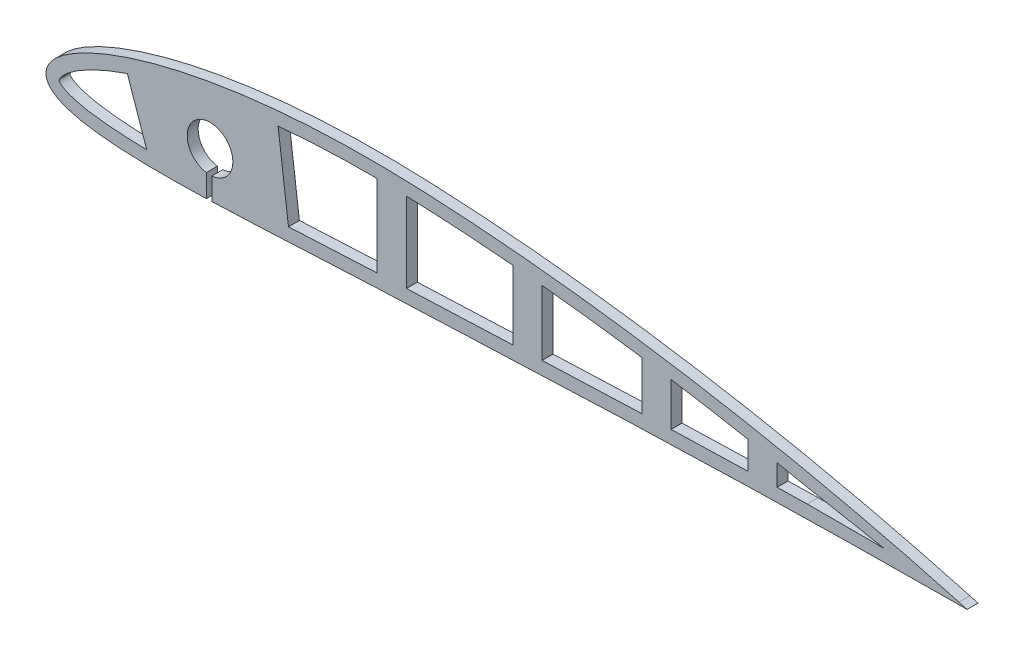
from build123d import *

# Parameters (mm, degrees)
BOSS_EXTRUDE1_DEPTH = 3
CUT_EXTRUDE1_DEPTH  = 10
BOSS_EXTRUDE2_DEPTH = 3
BOSS_EXTRUDE3_DEPTH = 3
SKETCH5_R           = 6.25
CUT_EXTRUDE2_DEPTH  = 3
SKETCH9_W           = 1.5
SKETCH9_H           = 11.04620158
CUT_EXTRUDE3_DEPTH  = 3


with BuildPart() as part:
    # Sketch1 → Boss-Extrude1 (new body)
    with BuildSketch(Plane.XY.offset(1594.665639607)):
        with BuildLine():
            Line((571.512797284, 751.460872145), (569.288571103, 752.085372145))
            add(Edge.make_bspline(
                [(569.288571103, 752.085372145), (569.207824398, 752.107800703), (568.885254245, 752.197399197), (568.160451757, 752.397346563), (566.955590863, 752.729020554), (565.274314978, 753.186620677), (562.100922103, 754.041070604), (558.315248382, 755.035797885), (553.929688252, 756.155409854), (549.988735218, 757.138311996), (545.631545263, 758.196335617), (540.874229892, 759.318134415), (535.733835559, 760.490840684), (530.229687155, 761.703261755), (524.381807715, 762.940721946), (518.212626171, 764.192645876), (511.745065536, 765.44442469), (505.003838301, 766.68395258), (498.015031084, 767.899775904), (490.805315338, 769.077912541), (483.40297947, 770.208104073), (475.836849627, 771.277976405), (468.136926681, 772.276980903), (460.333698001, 773.193978501), (452.458416415, 774.019905164), (444.542771888, 774.745192383), (436.619035759, 775.36189665), (428.71943342, 775.860738937), (420.844010206, 776.243529693), (413.014923526, 776.479731081), (405.264834959, 776.508750538), (397.661509603, 776.343451763), (390.247613389, 775.98562141), (383.05672298, 775.440827622), (376.121242905, 774.719270378), (369.472500577, 773.831502684), (363.14007733, 772.79132549), (357.151942782, 771.613480595), (351.533942201, 770.315331624), (346.309786675, 768.914972062), (341.501037062, 767.431379025), (337.12665352, 765.883899619), (333.202701315, 764.292771048), (329.743150488, 762.676281216), (326.758730352, 761.052775328), (324.257400211, 759.438394996), (322.243393842, 757.846645355), (320.717813869, 756.285368109), (319.680643215, 754.753750296), (319.14584497, 753.23689022), (319.158988787, 751.75550039), (319.715829141, 750.384255644), (320.782461654, 749.188263072), (322.304020001, 748.161146712), (324.269997101, 747.277585802), (326.676265952, 746.525537916), (329.516452781, 745.900149883), (332.780119389, 745.397056661), (336.454163781, 745.012195766), (340.523607036, 744.740673832), (344.971925843, 744.575293946), (349.781621882, 744.510287577), (354.93413472, 744.535655661), (360.410377123, 744.643127394), (366.190534641, 744.821621769), (372.254339569, 745.060094915), (378.580714755, 745.345694536), (385.148343595, 745.666469836), (391.935034571, 746.008922971), (398.918329162, 746.359747912), (406.07476137, 746.70536498), (413.388840069, 747.036214061), (420.868758886, 747.32738551), (428.485589125, 747.623976291), (436.201752576, 747.941269463), (443.955470082, 748.263874579), (451.717294434, 748.585963452), (459.457375674, 748.901819908), (467.14598863, 749.205730899), (474.753126072, 749.493512161), (482.249027102, 749.76210232), (489.604127028, 750.008614341), (496.789137122, 750.232643978), (503.775418318, 750.43266223), (510.534699403, 750.609283097), (517.039571485, 750.762933928), (523.263427655, 750.895745038), (529.180632964, 751.007800712), (534.766738431, 751.102455094), (539.998424273, 751.181117023), (544.853860816, 751.245362272), (549.312372949, 751.297797505), (553.355050668, 751.339855306), (556.96447185, 751.373675903), (560.125145125, 751.399809004), (562.823316535, 751.419920043), (565.047317639, 751.435472176), (566.787319157, 751.446681427), (568.03573631, 751.454290557), (568.786905041, 751.458351465), (569.121404462, 751.460367808), (569.205071103, 751.460872145)],
                knots=[0, 0, 0, 0, 0.00049114, 0.001962026, 0.004406441, 0.007815002, 0.012173731, 0.023666751, 0.030754195, 0.03869996, 0.047470457, 0.057031796, 0.067345089, 0.078369975, 0.090062358, 0.102375665, 0.115261553, 0.128668992, 0.142544999, 0.156834627, 0.171481882, 0.186428999, 0.20161683, 0.216985201, 0.232474114, 0.248022541, 0.26356855, 0.279050795, 0.294409506, 0.309776014, 0.324950676, 0.339824564, 0.354341727, 0.368445782, 0.382082852, 0.395201613, 0.407751475, 0.419686064, 0.430961955, 0.441537443, 0.451376776, 0.460447412, 0.468722555, 0.476182576, 0.482814922, 0.488618664, 0.493609655, 0.497829925, 0.501364694, 0.504371831, 0.507112525, 0.509853115, 0.512854813, 0.516367769, 0.520539593, 0.525445047, 0.531118393, 0.537568298, 0.54478829, 0.552761791, 0.561466343, 0.570873121, 0.580950015, 0.591662174, 0.602972463, 0.614840809, 0.627226871, 0.640086431, 0.653376876, 0.66705154, 0.681064304, 0.695366713, 0.709960022, 0.724934164, 0.740039735, 0.755219531, 0.770414901, 0.785567805, 0.800618776, 0.815509934, 0.830182038, 0.844577389, 0.858639376, 0.872310909, 0.885537901, 0.898266278, 0.910443942, 0.922021684, 0.932950823, 0.943186535, 0.952685933, 0.961409058, 0.969317876, 0.976379715, 0.982563346, 0.987841939, 0.992193049, 0.995597639, 0.998039598, 0.999509655, 1, 1, 1, 1], degree=3))
            Line((569.205071103, 751.460872145), (571.512797284, 751.460872145))
        make_face()
    extrude(amount=BOSS_EXTRUDE1_DEPTH)

    # Sketch2 → Cut-Extrude1 (cut)
    with BuildSketch(Plane.XY.offset(1597.665639607)):
        with BuildLine():
            Line((527.041704463, 758.69590343), (548.794499534, 754.579956264))
            Line((548.794499534, 754.579956264), (527.722682266, 754.579956264))
            add(Edge.make_bspline(
                [(527.041704463, 758.69590343), (518.368284944, 760.536594861), (500.950978516, 763.899738476), (474.662755288, 767.966000717), (452.645451426, 770.484332396), (434.994679734, 771.898468873), (421.727615633, 772.648203488), (408.516759001, 772.989727697), (395.310896209, 772.71864115), (382.151263879, 771.826767862), (369.079364983, 770.23428092), (358.316650731, 768.246020376), (349.847017874, 766.177458164), (343.595662562, 764.354061799), (338.506761023, 762.568519649), (334.55779133, 760.943270005), (331.680568798, 759.611018418), (328.925916643, 758.148277717), (326.789286317, 756.800893271), (325.257544247, 755.64510876), (324.235565822, 754.744504043), (323.406792878, 753.836658551), (322.970632977, 753.163224074), (322.805951986, 752.751638489), (322.77195968, 752.594581724), (322.77367997, 752.490434745), (322.775742869, 752.475167183), (322.811421134, 752.379825872), (322.921183732, 752.207285635), (323.392072021, 751.748890322), (324.359378973, 751.180854432), (325.966783045, 750.493848282), (328.321033056, 749.816672063), (331.356822172, 749.2375688), (334.503751977, 748.822968385), (337.710221317, 748.531014844), (342.03591096, 748.265965781), (347.499816407, 748.114575192), (354.101894477, 748.118596174), (360.7280692, 748.248701153), (369.584327157, 748.537580932), (380.681424616, 749.041685822), (394.026446313, 749.720427389), (407.390241464, 750.387766113), (420.787414665, 750.92975013), (434.121181325, 751.452529378), (451.932195739, 752.203204104), (474.205259986, 753.10525232), (500.958282025, 753.996523571), (518.800887351, 754.415426806), (527.722682266, 754.579956264)],
                knots=[0.083464926, 0.083464926, 0.083464926, 0.083464926, 0.135691273, 0.18791762, 0.240143968, 0.266257141, 0.292370315, 0.318483489, 0.344596662, 0.370709836, 0.39682301, 0.422936183, 0.43599277, 0.449049357, 0.462105944, 0.468634237, 0.475162531, 0.481690824, 0.488219118, 0.491483264, 0.494747411, 0.498011558, 0.501275704, 0.502907778, 0.504539851, 0.506171925, 0.507803998, 0.509436071, 0.511068145, 0.514332291, 0.517596438, 0.520860585, 0.527388878, 0.533917172, 0.540445465, 0.546973758, 0.553502052, 0.566558639, 0.579615225, 0.592671812, 0.605728399, 0.631841573, 0.657954747, 0.68406792, 0.710181094, 0.736294268, 0.762407441, 0.814633789, 0.866860136, 0.919086483, 0.919086483, 0.919086483, 0.919086483], degree=3))
        make_face()
    extrude(amount=-CUT_EXTRUDE1_DEPTH, mode=Mode.SUBTRACT)

    # Sketch3 → Boss-Extrude2 (add)
    with BuildSketch(Plane.XY.offset(1597.665639607)):
        with BuildLine():
            add(Edge.make_bspline(
                [(382.758905151, 771.76543999), (382.561202683, 771.747197456), (379.904194339, 771.498800771), (377.252585122, 771.207288223), (374.804916535, 770.897771903)],
                knots=[0.369529327, 0.369529327, 0.369529327, 0.369529327, 0.370709836, 0.385397047, 0.385397047, 0.385397047, 0.385397047], degree=3))
            Line((374.804916535, 770.897771903), (377.585727665, 748.90699597))
            add(Edge.make_bspline(
                [(377.585727667, 748.906995971), (378.618933077, 748.955110808), (381.289473967, 749.08200027), (383.961731629, 749.213335473), (385.600396255, 749.294804162)],
                knots=[0.625766645, 0.625766645, 0.625766645, 0.625766645, 0.631841573, 0.641464235, 0.641464235, 0.641464235, 0.641464235], degree=3))
            Line((385.600396256, 749.294804162), (382.758905151, 771.76543999))
        make_face()
        with BuildLine():
            add(Edge.make_bspline(
                [(417.919887248, 772.719769697), (415.251321205, 772.804390114), (412.585285694, 772.860477687), (409.91988725, 772.88047535)],
                knots=[0.299903552, 0.299903552, 0.299903552, 0.299903552, 0.315711199, 0.315711199, 0.315711199, 0.315711199], degree=3))
            Line((409.919887248, 772.88047535), (409.919887248, 750.478803707))
            add(Edge.make_bspline(
                [(409.919887248, 750.478803707), (412.586801618, 750.594945391), (415.254616608, 750.70481459), (417.919887248, 750.812189624)],
                knots=[0.688992939, 0.688992939, 0.688992939, 0.688992939, 0.704601746, 0.704601746, 0.704601746, 0.704601746], degree=3))
            Line((417.919887248, 750.812189624), (417.919887248, 772.719769697))
        make_face()
        with BuildLine():
            add(Edge.make_bspline(
                [(455.083490977, 770.120428038), (452.799827852, 770.356033023), (450.133266111, 770.615861782), (447.465578217, 770.857377153), (447.083490976, 770.891589903)],
                knots=[0.226609611, 0.226609611, 0.226609611, 0.226609611, 0.240143968, 0.242406359, 0.242406359, 0.242406359, 0.242406359], degree=3))
            Line((447.083490977, 770.891589903), (447.083490977, 751.996613173))
            add(Edge.make_bspline(
                [(447.083490977, 751.996613173), (447.215680673, 752.002116002), (449.882122804, 752.113076674), (452.548787115, 752.22316989), (455.083490977, 752.326510537)],
                knots=[0.761632316, 0.761632316, 0.761632316, 0.761632316, 0.762407441, 0.777267554, 0.777267554, 0.777267554, 0.777267554], degree=3))
            Line((455.083490977, 752.326510537), (455.083490977, 770.120428038))
        make_face()
        with BuildLine():
            add(Edge.make_bspline(
                [(490.43237407, 765.479256454), (487.767981318, 765.901082187), (485.101268135, 766.307403818), (482.43237407, 766.697912356)],
                knots=[0.156573979, 0.156573979, 0.156573979, 0.156573979, 0.172465144, 0.172465144, 0.172465144, 0.172465144], degree=3))
            Line((482.43237407, 766.697912356), (482.43237407, 753.367431221))
            add(Edge.make_bspline(
                [(482.43237407, 753.367431221), (485.098750692, 753.459610943), (487.765438844, 753.548612033), (490.43237407, 753.634114728)],
                knots=[0.830691641, 0.830691641, 0.830691641, 0.830691641, 0.846310521, 0.846310521, 0.846310521, 0.846310521], degree=3))
            Line((490.43237407, 753.634114728), (490.43237407, 765.479256454))
        make_face()
        with BuildLine():
            add(Edge.make_bspline(
                [(519.460485141, 760.262421947), (516.796824086, 760.797940941), (514.130078888, 761.318412938), (511.460485141, 761.823724137)],
                knots=[0.098663944, 0.098663944, 0.098663944, 0.098663944, 0.114666423, 0.114666423, 0.114666423, 0.114666423], degree=3))
            Line((511.460485141, 761.823724137), (511.460485141, 754.230536955))
            add(Edge.make_bspline(
                [(511.460485141, 754.230536955), (514.127047816, 754.295914278), (516.793726254, 754.35733758), (519.460485141, 754.41477741)],
                knots=[0.887352991, 0.887352991, 0.887352991, 0.887352991, 0.9029644, 0.9029644, 0.9029644, 0.9029644], degree=3))
            Line((519.460485141, 754.41477741), (519.460485141, 760.262421947))
        make_face()
        with BuildLine():
            Line((349.112329297, 765.928755602), (355.209243286, 748.152516598))
            add(Edge.make_bspline(
                [(346.750239012, 748.157005911), (347.002511916, 748.152750923), (349.447153135, 748.115761213), (352.268199999, 748.117479366), (354.841358192, 748.147650416), (355.209243286, 748.152516598)],
                knots=[0.565055492, 0.565055492, 0.565055492, 0.565055492, 0.566558639, 0.579615225, 0.581792605, 0.581792605, 0.581792605, 0.581792605], degree=3))
            Line((346.750239012, 748.157005911), (341.459042292, 763.584085524))
            add(Edge.make_bspline(
                [(349.112329297, 765.928755602), (347.266102405, 765.423797937), (344.70267158, 764.66723758), (342.175831862, 763.829930799), (341.459042292, 763.584085524)],
                knots=[0.437551307, 0.437551307, 0.437551307, 0.437551307, 0.449049357, 0.453635476, 0.453635476, 0.453635476, 0.453635476], degree=3))
        make_face()
    extrude(amount=-BOSS_EXTRUDE2_DEPTH)

    # Sketch6 → Boss-Extrude3 (add)
    with BuildSketch(Plane.XY.offset(1597.665639607)):
        with BuildLine():
            Line((374.804916535, 770.897771903), (377.585727665, 748.90699597))
            add(Edge.make_bspline(
                [(355.209243286, 748.152516598), (357.04736904, 748.176830316), (361.097297358, 748.260744902), (368.554174209, 748.503978664), (374.17768304, 748.748288407), (377.585727665, 748.90699597)],
                knots=[0.581792605, 0.581792605, 0.581792605, 0.581792605, 0.592671812, 0.605728399, 0.625766645, 0.625766645, 0.625766645, 0.625766645], degree=3))
            Line((355.209243286, 748.152516598), (349.112329297, 765.928755602))
            add(Edge.make_bspline(
                [(374.804916535, 770.897771903), (372.900744768, 770.656982671), (366.657993293, 769.786966453), (358.316650731, 768.246020376), (351.711675603, 766.632868757), (349.36258152, 765.997201566), (349.112329297, 765.928755602)],
                knots=[0.385397047, 0.385397047, 0.385397047, 0.385397047, 0.39682301, 0.422936183, 0.43599277, 0.437551307, 0.437551307, 0.437551307, 0.437551307], degree=3))
        make_face()
    extrude(amount=-BOSS_EXTRUDE3_DEPTH)

    # Sketch5 → Cut-Extrude2 (cut)
    with BuildSketch(Plane.XY.offset(1597.665639607)):
        with Locations((364.112329297, 757.079956264)):
            Circle(SKETCH5_R)
    extrude(amount=-CUT_EXTRUDE2_DEPTH, mode=Mode.SUBTRACT)

    # Sketch9 → Cut-Extrude3 (cut)
    with BuildSketch(Plane.XY.offset(1597.665639607)):
        with Locations((363.862329297, 748.702343972)):
            Rectangle(SKETCH9_W, SKETCH9_H)
    extrude(amount=-CUT_EXTRUDE3_DEPTH, mode=Mode.SUBTRACT)


solid = part.part
